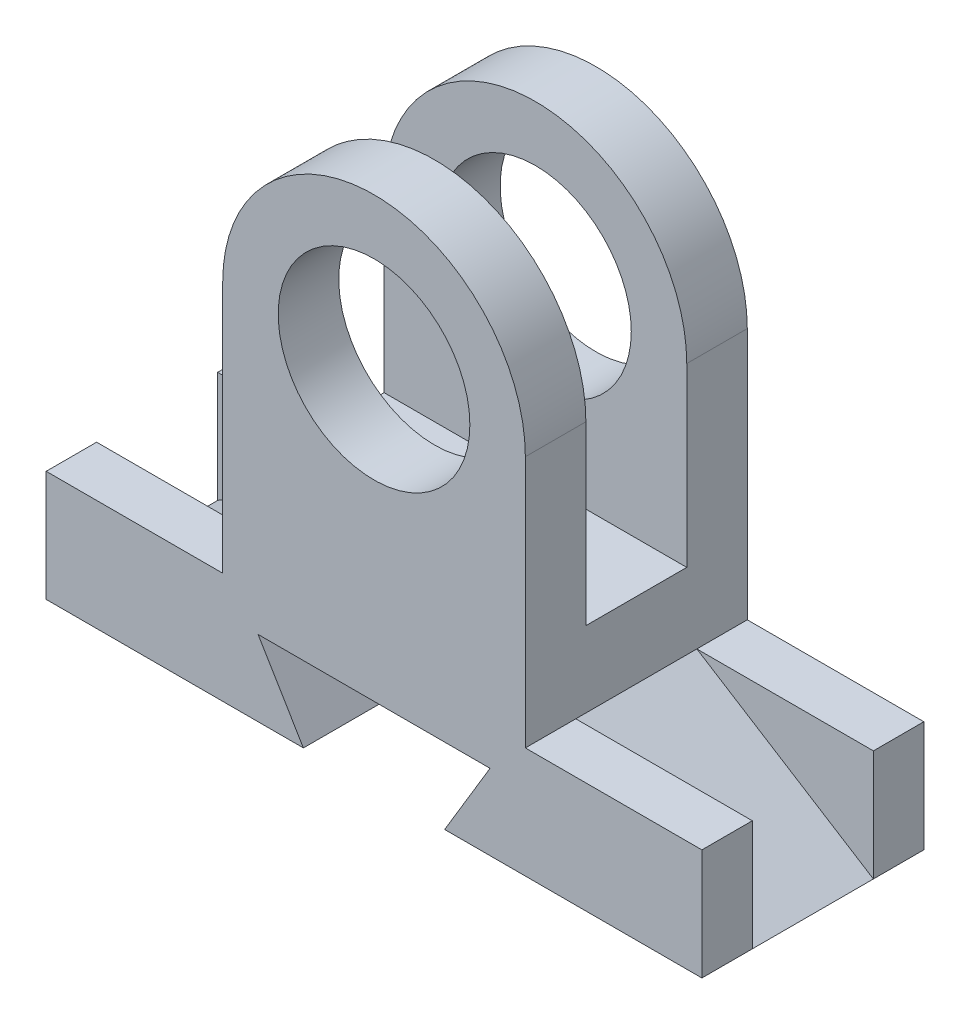
from build123d import *

# Parameters (mm, degrees)
BOSS_EXTRUDE1_DEPTH      = 22
BOSS_EXTRUDE1_DEPTH_BACK = 22
CUT_EXTRUDE1_DEPTH       = 12
CUT_EXTRUDE1_DEPTH_BACK  = 12
BOSS_EXTRUDE2_DEPTH      = 22
BOSS_EXTRUDE2_DEPTH_BACK = 22
SKETCH1_4_R              = 19
SKETCH2_W                = 20
SKETCH2_H                = 71.319649742
CUT_EXTRUDE2_DEPTH       = 134.379158792


with BuildPart() as part:
    # Sketch1 → Boss-Extrude1 (new, two sides: drawn at the far end of the back side and taken through both)
    with BuildSketch(Plane.XY.offset(-BOSS_EXTRUDE1_DEPTH_BACK)):
        Polygon((-65, 11), (-65, -11), (-14, -11), (-23, 4), (23, 4), (14, -11), (65, -11), (65, 11), align=None)
    extrude(amount=BOSS_EXTRUDE1_DEPTH + BOSS_EXTRUDE1_DEPTH_BACK)

    # Sketch1<3> → Cut-Extrude1 (cut, two sides: drawn at the far end of the back side and taken through both)
    with BuildSketch(Plane.XY.offset(-CUT_EXTRUDE1_DEPTH_BACK)):
        Polygon((-65, 11), (-65, -11), (-30, 11), align=None)
        Polygon((65, 11), (30, 11), (65, -11), align=None)
    extrude(amount=CUT_EXTRUDE1_DEPTH + CUT_EXTRUDE1_DEPTH_BACK, mode=Mode.SUBTRACT)

    # Sketch1<4> → Boss-Extrude2 (add, two sides: drawn at the far end of the back side and taken through both)
    with BuildSketch(Plane.XY.offset(-BOSS_EXTRUDE2_DEPTH_BACK)):
        with BuildLine():
            Line((-30, 61), (-30, 11))
            Line((-30, 11), (30, 11))
            Line((30, 11), (30, 61))
            ThreePointArc((30, 61), (0, 91), (-30, 61))
        make_face()
        with Locations((0, 61)):
            Circle(SKETCH1_4_R, mode=Mode.SUBTRACT)
    extrude(amount=BOSS_EXTRUDE2_DEPTH + BOSS_EXTRUDE2_DEPTH_BACK)

    # Sketch2 → Cut-Extrude2 (cut, through all)
    with BuildSketch(Plane(origin=(30, 0, 0), x_dir=(0, 0, -1), z_dir=(1, 0, 0))):
        with Locations((0, 61.659824871)):
            Rectangle(SKETCH2_W, SKETCH2_H)
    extrude(amount=-CUT_EXTRUDE2_DEPTH, mode=Mode.SUBTRACT)


solid = part.part
